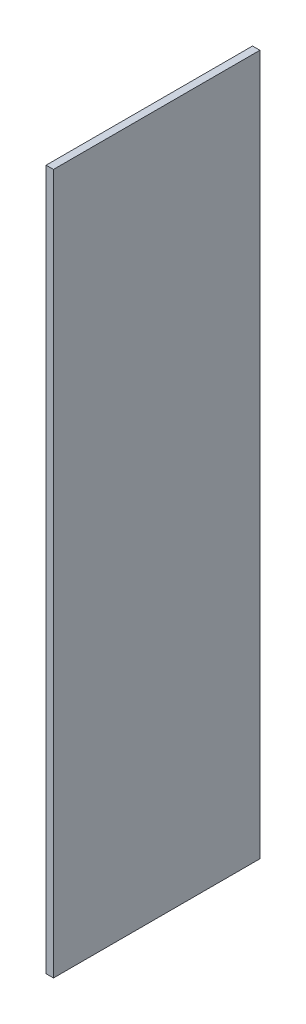
from build123d import *

# Parameters (mm, degrees)
SKETCH1_W           = 950
SKETCH1_H           = 280
BOSS_EXTRUDE1_DEPTH = 10


with BuildPart() as part:
    # Sketch1 → Boss-Extrude1 (new body)
    with BuildSketch(Plane.YZ):
        Rectangle(SKETCH1_W, SKETCH1_H)
    extrude(amount=BOSS_EXTRUDE1_DEPTH)


solid = part.part
